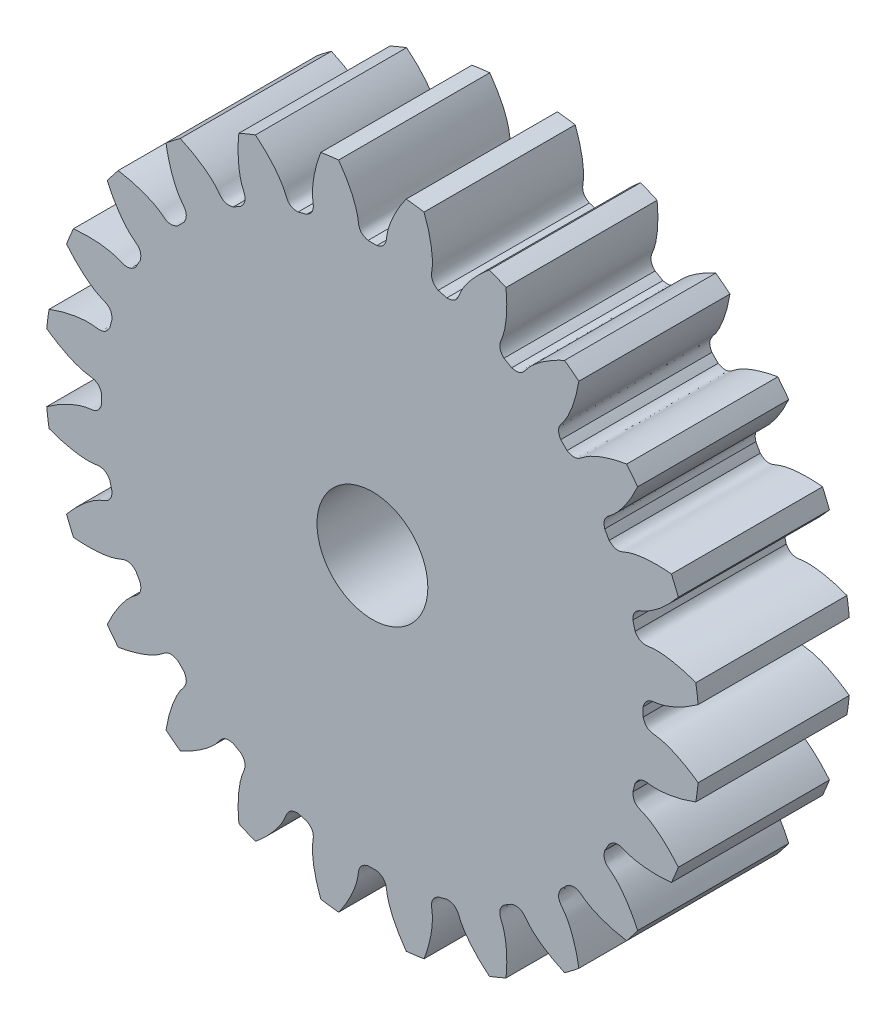
from build123d import *

# Parameters (mm, degrees)
SKETCH_1_R               = 6.5
EXTRUDE_1_DEPTH          = 3
CUT_EXTRUDE_1_DEPTH      = 10.669539803
PATTERN_CIRCULAR_1_COUNT = 24
CUT_EXTRUDE_2_REACH      = 11.623
SKETCH_4_R               = 1.1


with BuildPart() as part:
    # 草图1 → 凸台-拉伸1 (new body)
    with BuildSketch(Plane.XY):
        Circle(SKETCH_1_R)
    extrude(amount=EXTRUDE_1_DEPTH)

    # 草图2 → 切除-拉伸1 (cut, through all)
    with BuildSketch(Plane.XY):
        with BuildLine():
            ThreePointArc((0.088415956, 5.374272753), (0, 5.375), (-0.088415956, 5.374272753))
            add(Edge.make_bspline(
                [(-0.088415956, 5.374272753), (-0.283956108, 5.428430036), (-0.269523883, 5.557861799), (-0.293138588, 5.686342226), (-0.296517959, 5.702916521), (-0.300724242, 5.721620073), (-0.305840304, 5.742426358), (-0.311952817, 5.765305336), (-0.319146149, 5.790224685), (-0.327504211, 5.817149434), (-0.337109789, 5.846042111), (-0.348044663, 5.876862729), (-0.360389484, 5.909568827), (-0.374223721, 5.944115495), (-0.389625595, 5.980455405), (-0.406672011, 6.018538843), (-0.425438499, 6.058313744), (-0.445999145, 6.099725726), (-0.468426535, 6.142718129), (-0.492791687, 6.187232054), (-0.519163995, 6.233206399), (-0.547611171, 6.280577906), (-0.57819918, 6.329281201), (-0.610992189, 6.379248841), (-0.64605251, 6.430411359), (-0.68344054, 6.482697309), (-0.723214712, 6.53603332), (-0.765431443, 6.590344144), (-0.810145078, 6.645552705), (-0.857407842, 6.701580158), (-0.907269792, 6.758345935), (-0.959778768, 6.81576781), (-1.014980347, 6.873761948), (-1.0729178, 6.932242967), (-1.133632047, 6.991123994), (-1.197161611, 7.05031673), (-1.263542589, 7.109731505), (-1.332808587, 7.169277345), (-1.430211047, 7.249680778), (-1.505961903, 7.308439159), (-1.55780976, 7.347058965)],
                knots=[0, 0, 0, 0, 0.143961355, 0.149818462, 0.156576662, 0.164235955, 0.172796342, 0.182257821, 0.192620395, 0.203884061, 0.216048821, 0.229114674, 0.24308162, 0.25794966, 0.273718793, 0.290389019, 0.307960339, 0.326432751, 0.345806258, 0.366080857, 0.38725655, 0.409333336, 0.432311215, 0.456190188, 0.480970254, 0.506651413, 0.533233666, 0.560717012, 0.589101451, 0.618386984, 0.64857361, 0.679661329, 0.711650141, 0.744540047, 0.778331046, 0.813023138, 0.848616324, 0.885110603, 0.922505975, 1, 1, 1, 1], degree=3))
            ThreePointArc((-1.55780976, 7.347058965), (0, 7.510395907), (1.55780976, 7.347058965))
            add(Edge.make_bspline(
                [(0.088415956, 5.374272753), (0.283956108, 5.428430036), (0.269523883, 5.557861799), (0.293138588, 5.686342226), (0.296517959, 5.702916521), (0.300724242, 5.721620073), (0.305840304, 5.742426358), (0.311952817, 5.765305336), (0.319146149, 5.790224685), (0.327504211, 5.817149434), (0.337109789, 5.846042111), (0.348044663, 5.876862729), (0.360389484, 5.909568827), (0.374223721, 5.944115495), (0.389625595, 5.980455405), (0.406672011, 6.018538843), (0.425438499, 6.058313744), (0.445999145, 6.099725726), (0.468426535, 6.142718129), (0.492791687, 6.187232054), (0.519163995, 6.233206399), (0.547611171, 6.280577906), (0.57819918, 6.329281201), (0.610992189, 6.379248841), (0.64605251, 6.430411359), (0.68344054, 6.482697309), (0.723214712, 6.53603332), (0.765431443, 6.590344144), (0.810145078, 6.645552705), (0.857407842, 6.701580158), (0.907269792, 6.758345935), (0.959778768, 6.81576781), (1.014980347, 6.873761948), (1.0729178, 6.932242967), (1.133632047, 6.991123994), (1.197161611, 7.05031673), (1.263542589, 7.109731505), (1.332808587, 7.169277345), (1.430211047, 7.249680778), (1.505961903, 7.308439159), (1.55780976, 7.347058965)],
                knots=[0, 0, 0, 0, 0.143961355, 0.149818462, 0.156576662, 0.164235955, 0.172796342, 0.182257821, 0.192620395, 0.203884061, 0.216048821, 0.229114674, 0.24308162, 0.25794966, 0.273718793, 0.290389019, 0.307960339, 0.326432751, 0.345806258, 0.366080857, 0.38725655, 0.409333336, 0.432311215, 0.456190188, 0.480970254, 0.506651413, 0.533233666, 0.560717012, 0.589101451, 0.618386984, 0.64857361, 0.679661329, 0.711650141, 0.744540047, 0.778331046, 0.813023138, 0.848616324, 0.885110603, 0.922505975, 1, 1, 1, 1], degree=3))
        make_face()
    cut_extrude_1 = extrude(amount=CUT_EXTRUDE_1_DEPTH, mode=Mode.SUBTRACT)

    # 阵列(圆周)1: 切除-拉伸1 ×24 about axis
    pattern_circular_1_axis = Axis((0, 0, 3), (0, 0, -1))
    for i in range(1, PATTERN_CIRCULAR_1_COUNT):
        add(cut_extrude_1.rotate(pattern_circular_1_axis, i * 360 / PATTERN_CIRCULAR_1_COUNT), mode=Mode.SUBTRACT)

    # 草图4 → 切除-拉伸2 (cut, up to next)
    with BuildSketch(Plane.XY.offset(3), mode=Mode.PRIVATE) as cut_extrude_2_sk1:
        Circle(SKETCH_4_R)
    cut_extrude_2_tool1 = extrude(cut_extrude_2_sk1.sketch, amount=-CUT_EXTRUDE_2_REACH, mode=Mode.PRIVATE) & part.part
    add(cut_extrude_2_tool1.solids().sort_by_distance((0, 0, 3))[0], mode=Mode.SUBTRACT)


solid = part.part
